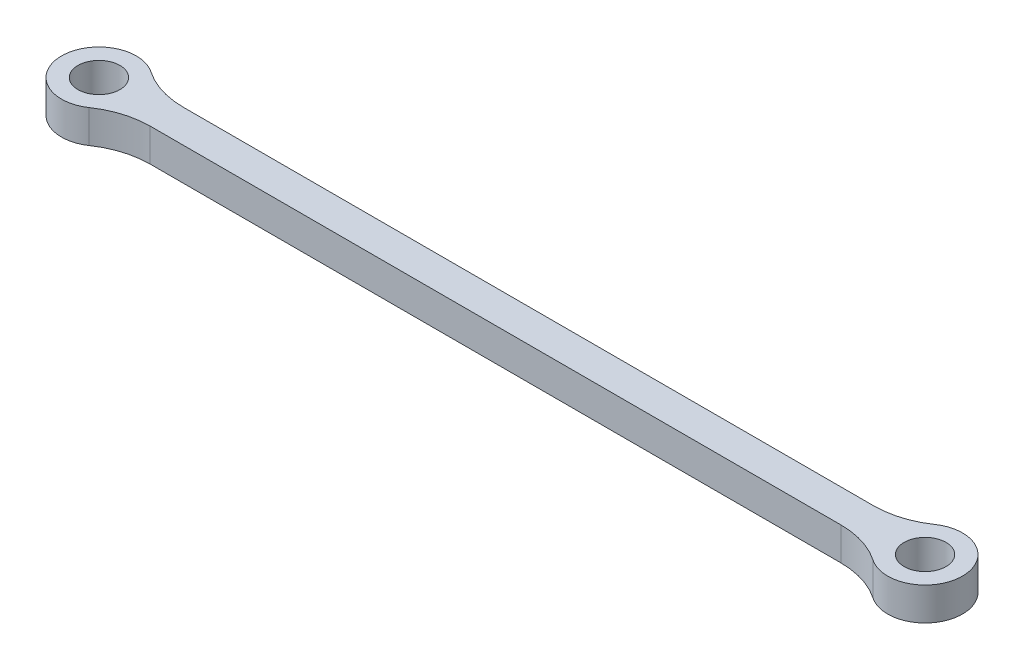
from build123d import *

# Parameters (mm, degrees)
BOSS_EXTRUDE1_DEPTH = 4
FILLET1_R           = 10


with BuildPart() as part:
    # Sketch1 → Boss-Extrude1 (new body)
    with BuildSketch(Plane(origin=(0, 0, 0), x_dir=(1, 0, 0), z_dir=(0, 1, 0))):
        with BuildLine():
            Line((-98.818070798, 2), (-96.313130783, 2))
            ThreePointArc((-96.313130783, 2), (-104.95, 0), (-96.313130783, -2))
            Line((-96.313130783, -2), (-98.818070798, -2))
            ThreePointArc((-98.818070798, -2), (-102.95, 0), (-98.818070798, 2))
        make_face()
        with BuildLine():
            Line((-4.55, 0), (-95.85, 0))
            ThreePointArc((-95.85, 0), (-95.967294565, -1.026461169), (-96.313130783, -2))
            Line((-96.313130783, -2), (-4.086869217, -2))
            ThreePointArc((-4.086869217, -2), (-4.432705435, -1.026461169), (-4.55, 0))
        make_face()
        with BuildLine():
            ThreePointArc((-96.313130783, 2), (-95.967294565, 1.026461169), (-95.85, 0))
            Line((-95.85, 0), (-4.55, 0))
            ThreePointArc((-4.55, 0), (-4.432705435, 1.026461169), (-4.086869217, 2))
            Line((-4.086869217, 2), (-96.313130783, 2))
        make_face()
        with BuildLine():
            Line((-97.85, 0), (-95.85, 0))
            ThreePointArc((-95.85, 0), (-95.967294565, 1.026461169), (-96.313130783, 2))
            Line((-96.313130783, 2), (-98.818070798, 2))
            ThreePointArc((-98.818070798, 2), (-98.104741903, 1.110986169), (-97.85, 0))
        make_face()
        with BuildLine():
            ThreePointArc((-96.313130783, -2), (-95.967294565, -1.026461169), (-95.85, 0))
            Line((-95.85, 0), (-97.85, 0))
            ThreePointArc((-97.85, 0), (-98.104741903, -1.110986169), (-98.818070798, -2))
            Line((-98.818070798, -2), (-96.313130783, -2))
        make_face()
        with BuildLine():
            ThreePointArc((4.55, 0), (1.026461169, 4.432705435), (-4.086869217, 2))
            Line((-4.086869217, 2), (-1.581929202, 2))
            ThreePointArc((-1.581929202, 2), (1.110986169, 2.295258097), (2.55, 0))
            ThreePointArc((2.55, 0), (1.110986169, -2.295258097), (-1.581929202, -2))
            Line((-1.581929202, -2), (-4.086869217, -2))
            ThreePointArc((-4.086869217, -2), (1.026461169, -4.432705435), (4.55, 0))
        make_face()
        with BuildLine():
            ThreePointArc((-4.086869217, 2), (-4.432705435, 1.026461169), (-4.55, 0))
            Line((-4.55, 0), (-2.55, 0))
            ThreePointArc((-2.55, 0), (-2.295258097, 1.110986169), (-1.581929202, 2))
            Line((-1.581929202, 2), (-4.086869217, 2))
        make_face()
        with BuildLine():
            Line((-2.55, 0), (-4.55, 0))
            ThreePointArc((-4.55, 0), (-4.432705435, -1.026461169), (-4.086869217, -2))
            Line((-4.086869217, -2), (-1.581929202, -2))
            ThreePointArc((-1.581929202, -2), (-2.295258097, -1.110986169), (-2.55, 0))
        make_face()
    extrude(amount=BOSS_EXTRUDE1_DEPTH)

    # Fillet1
    fillet1_edges = [part.edges().sort_by_distance(p)[0] for p in [
        (-4.086869217, 2, 2),
        (-96.313130783, 2, 2),
        (-96.313130783, 2, -2),
        (-4.086869217, 2, -2),
    ]]
    fillet(fillet1_edges, radius=FILLET1_R)


solid = part.part
